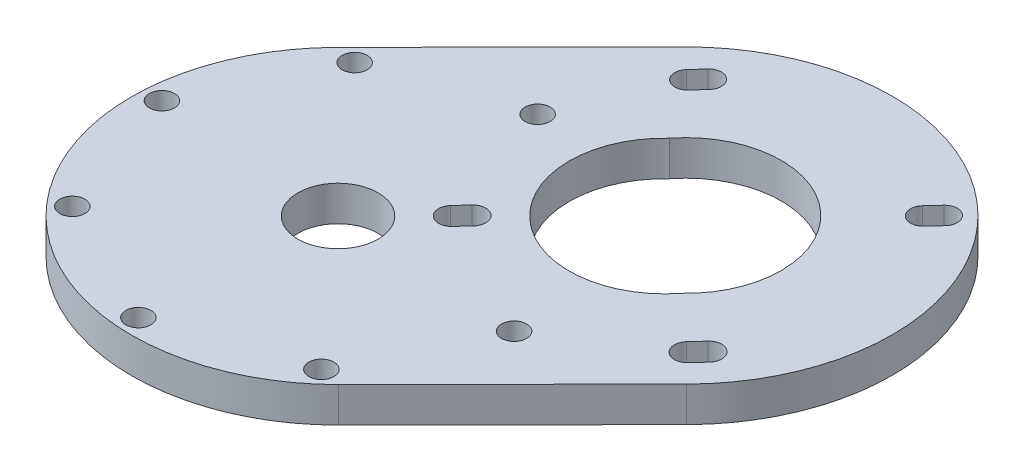
from build123d import *

# Parameters (mm, degrees)
SKETCH2_R           = 8
BOSS_EXTRUDE1_DEPTH = 7
SKETCH6_R           = 2.5
CUT_EXTRUDE2_DEPTH  = 10
CIRPATTERN1_COUNT   = 8


with BuildPart() as part:
    # Sketch2 → Boss-Extrude1 (new body)
    with BuildSketch(Plane(origin=(0, 0, 0), x_dir=(1, 0, 0), z_dir=(0, 1, 0))):
        with BuildLine():
            Line((57.48567214, -39.461643712), (92.069504062, -4.710791287))
            ThreePointArc((92.069504062, -4.710791287), (91.929351462, 53.470307056), (33.748253119, 53.330154455))
            Line((33.748253119, 53.330154455), (-0.835578803, 18.579302031))
            ThreePointArc((-0.835578803, 18.579302031), (-0.695426202, -39.601796312), (57.48567214, -39.461643712))
        make_face()
        with Locations(Location((28.325046669, -10.441170841, 0), (0, 0, 270))):
            Circle(SKETCH2_R, mode=Mode.SUBTRACT)
        with BuildLine():
            ThreePointArc((75.857560085, 10.405306461), (75.736496811, 38.325822665), (47.914533773, 35.978855656))
            ThreePointArc((47.914533773, 35.978855656), (48.035597047, 8.058339452), (75.857560085, 10.405306461))
        make_face(mode=Mode.SUBTRACT)
        with BuildLine():
            ThreePointArc((43.521692021, 48.399463186), (43.365065843, 51.936993301), (39.827535728, 51.780367124))
            Line((39.827535728, 51.780367124), (37.781872405, 49.545166072))
            ThreePointArc((37.781872405, 49.545166072), (37.938498583, 46.007635957), (41.476028698, 46.164262134))
            Line((41.476028698, 46.164262134), (43.521692021, 48.399463186))
        make_face(mode=Mode.SUBTRACT)
        with BuildLine():
            ThreePointArc((90.519256192, 48.401692465), (90.362836565, 51.934557472), (86.829971557, 51.778137845))
            Line((86.829971557, 51.778137845), (84.784308234, 49.542936793))
            ThreePointArc((84.784308234, 49.542936793), (84.940727861, 46.010071786), (88.473592869, 46.166491413))
            Line((88.473592869, 46.166491413), (90.519256192, 48.401692465))
        make_face(mode=Mode.SUBTRACT)
        with BuildLine():
            ThreePointArc((43.560284925, 1.364142834), (43.400386196, 4.975586205), (39.788942825, 4.815687476))
            Line((39.788942825, 4.815687476), (37.743279502, 2.580486424))
            ThreePointArc((37.743279502, 2.580486424), (37.903178231, -1.030956947), (41.514621602, -0.871058218))
            Line((41.514621602, -0.871058218), (43.560284925, 1.364142834))
        make_face(mode=Mode.SUBTRACT)
        with BuildLine():
            ThreePointArc((90.568112992, 1.356978562), (90.407550468, 4.983414272), (86.781114757, 4.822851748))
            Line((86.781114757, 4.822851748), (84.735451434, 2.587650696))
            ThreePointArc((84.735451434, 2.587650696), (84.896013958, -1.038785014), (88.522449669, -0.87822249))
            Line((88.522449669, -0.87822249), (90.568112992, 1.356978562))
        make_face(mode=Mode.SUBTRACT)
    extrude(amount=BOSS_EXTRUDE1_DEPTH)

    # Sketch6 → Cut-Extrude2 (cut)
    with BuildSketch(Plane(origin=(0, 7, 0), x_dir=(1, 0, 0), z_dir=(0, 1, 0))):
        with Locations(Location((3.517083482, 17.6802616, 0), (0, 0, 270))):
            Circle(SKETCH6_R)
    cut_extrude2 = extrude(amount=-CUT_EXTRUDE2_DEPTH, mode=Mode.SUBTRACT)

    # CirPattern1: Cut-Extrude2 ×8 about axis
    cirpattern1_axis = Axis((28.325046669, 0, 10.441170841), (0, 1, 0))
    for i in range(1, CIRPATTERN1_COUNT):
        add(cut_extrude2.rotate(cirpattern1_axis, i * 360 / CIRPATTERN1_COUNT), mode=Mode.SUBTRACT)


solid = part.part
